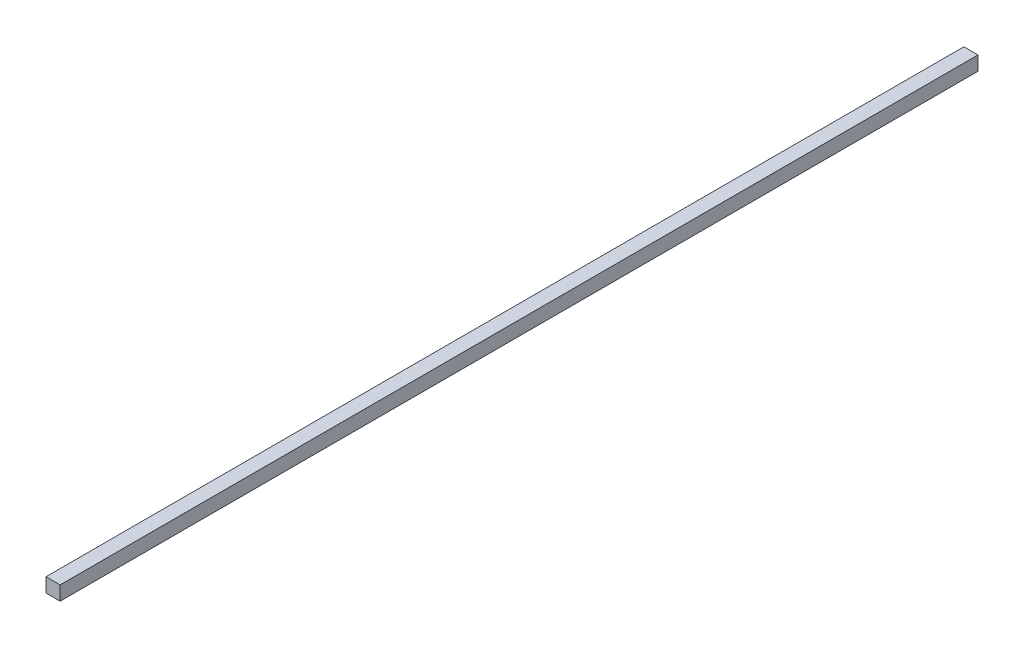
from build123d import *

# Parameters (mm, degrees)
SKETCH1_W           = 20
SKETCH1_H           = 20
BOSS_EXTRUDE1_DEPTH = 1300


with BuildPart() as part:
    # Sketch1 → Boss-Extrude1 (new body)
    with BuildSketch(Plane.XY):
        Rectangle(SKETCH1_W, SKETCH1_H)
    extrude(amount=BOSS_EXTRUDE1_DEPTH)


solid = part.part
